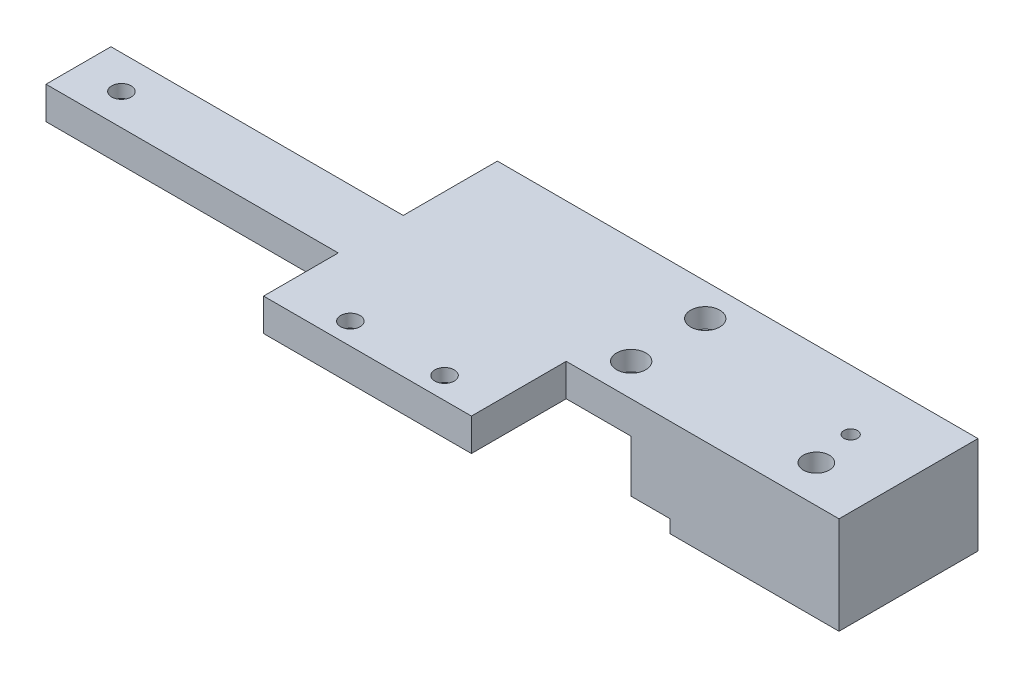
from build123d import *

# Parameters (mm, degrees)
SKETCH_1_W           = 42
SKETCH_1_H           = 21.4
EXTRUDE_1_DEPTH      = 12
SKETCH_2_W           = 6
SKETCH_2_H           = 2
CUT_EXTRUDE_1_DEPTH  = 49.641134855
SKETCH_3_R           = 5
CUT_EXTRUDE_2_DEPTH  = 5.5
SKETCH_3_3_R         = 8.5
CUT_EXTRUDE_3_DEPTH  = 3
SKETCH_3_4_R         = 3.5
CUT_EXTRUDE_4_DEPTH  = 7
SKETCH_3_5_R         = 5
CUT_EXTRUDE_5_DEPTH  = 8.5
CUT_EXTRUDE_START    = -8.5
SKETCH_3_6_R         = 3.1
CUT_EXTRUDE_6_DEPTH  = 2.6
CUT_EXTRUDE_START_2  = -5.5
SKETCH_3_7_R         = 3.1
CUT_EXTRUDE_7_DEPTH  = 2.6
EXTRUDE_START        = -2
SKETCH_4_W           = 42
SKETCH_4_H           = 21.4
SKETCH_4_W_2         = 45
SKETCH_4_H_2         = 10
EXTRUDE_2_DEPTH      = 5
SKETCH_5_R           = 2.25
CUT_EXTRUDE_8_DEPTH  = 3
SKETCH_5_3_R         = 1.5
CUT_EXTRUDE_9_DEPTH  = 86.586213843
SKETCH_3_8_R         = 1.05
SKETCH_3_8_R_2       = 2
CUT_EXTRUDE_10_DEPTH = 87.313382508
SKETCH_6_R           = 1.5
CUT_EXTRUDE_11_DEPTH = 87.313382508
SKETCH_6_3_R         = 2.25
CUT_EXTRUDE_12_DEPTH = 3
SKETCH_7_R           = 0.8
CUT_EXTRUDE_13_DEPTH = 4
SKETCH_3_9_R         = 3.1
CUT_EXTRUDE_14_DEPTH = 2.6


with BuildPart() as part:
    # 草图1 → 凸台-拉伸1 (new body)
    with BuildSketch(Plane(origin=(0, 0, 0), x_dir=(1, 0, 0), z_dir=(0, 1, 0))):
        with Locations((21, -10.7)):
            Rectangle(SKETCH_1_W, SKETCH_1_H)
    extrude(amount=EXTRUDE_1_DEPTH)

    # 草图2 → 切除-拉伸1 (cut, through all)
    with BuildSketch(Plane(origin=(0, 0, 0), x_dir=(-1, 0, 0), z_dir=(0, 0, -1))):
        Polygon((-10, 0), (0, 0), (0, 10), (-10, 10), (-10, 2), align=None)
        with Locations((-13, 1)):
            Rectangle(SKETCH_2_W, SKETCH_2_H)
    extrude(amount=-CUT_EXTRUDE_1_DEPTH, mode=Mode.SUBTRACT)

    # 草图3 → 切除-拉伸2 (cut)
    with BuildSketch(Plane.XZ):
        with Locations(Location((20.3, 7.4, 0), (0, 0, 270))):
            Circle(SKETCH_3_R)
    extrude(amount=-CUT_EXTRUDE_2_DEPTH, mode=Mode.SUBTRACT)

    # 草图3<3> → 切除-拉伸3 (cut)
    with BuildSketch(Plane.XZ):
        with Locations((31.64970263, 9.253173011)):
            Circle(SKETCH_3_3_R)
    extrude(amount=-CUT_EXTRUDE_3_DEPTH, mode=Mode.SUBTRACT)

    # 草图3<4> → 切除-拉伸4 (cut)
    with BuildSketch(Plane.XZ):
        with Locations(Location((31.64970263, 9.253173011, 0), (0, 0, 270))):
            Circle(SKETCH_3_4_R)
    extrude(amount=-CUT_EXTRUDE_4_DEPTH, mode=Mode.SUBTRACT)

    # 草图3<5> → 切除-拉伸5 (cut)
    with BuildSketch(Plane.XZ):
        with Locations(Location((32.76916715, 15.656047301, 0), (0, 0, 270))):
            Circle(SKETCH_3_5_R)
    extrude(amount=-CUT_EXTRUDE_5_DEPTH, mode=Mode.SUBTRACT)

    # 草图3<6> → 切除-拉伸6 (cut)
    with BuildSketch(Plane.XZ.offset(CUT_EXTRUDE_START)):
        with Locations(Location((32.76916715, 15.656047301, 0), (0, 0, 270))):
            Circle(SKETCH_3_6_R)
    extrude(amount=-CUT_EXTRUDE_6_DEPTH, mode=Mode.SUBTRACT)

    # 草图3<7> → 切除-拉伸7 (cut)
    with BuildSketch(Plane.XZ.offset(CUT_EXTRUDE_START_2)):
        with Locations(Location((20.3, 7.4, 0), (0, 0, 270))):
            Circle(SKETCH_3_7_R)
    extrude(amount=-CUT_EXTRUDE_7_DEPTH, mode=Mode.SUBTRACT)

    # 草图4 → 凸台-拉伸2 (add)
    with BuildSketch(Plane(origin=(0, 12, 0), x_dir=(1, 0, 0), z_dir=(0, 1, 0)).offset(EXTRUDE_START)):
        with Locations((21, -10.7)):
            Rectangle(SKETCH_4_W, SKETCH_4_H)
        Polygon((0, -21.4), (0, 0), (-32, 0), (-32, -14.5), (-32, -24.5), (-32, -36), (0, -36), align=None)
        with Locations((-54.5, -19.5)):
            Rectangle(SKETCH_4_W_2, SKETCH_4_H_2)
    extrude(amount=EXTRUDE_2_DEPTH)

    # 草图5 → 切除-拉伸8 (cut)
    with BuildSketch(Plane.XZ.offset(-10)):
        with Locations((-7.480832871, 32.656047307)):
            Circle(SKETCH_5_R)
        with Locations((-21.980832871, 32.656047307)):
            Circle(SKETCH_5_R)
        with Locations((-70.230832871, 19.656047307)):
            Circle(SKETCH_5_R)
    extrude(amount=-CUT_EXTRUDE_8_DEPTH, mode=Mode.SUBTRACT)

    # 草图5<3> → 切除-拉伸9 (cut, through all)
    with BuildSketch(Plane.XZ.offset(-10)):
        with Locations((-70.230832871, 19.656047307)):
            Circle(SKETCH_5_3_R)
        with Locations((-21.980832871, 32.656047307)):
            Circle(SKETCH_5_3_R)
        with Locations((-7.480832871, 32.656047307)):
            Circle(SKETCH_5_3_R)
    extrude(amount=-CUT_EXTRUDE_9_DEPTH, mode=Mode.SUBTRACT)

    # 草图3<8> → 切除-拉伸10 (cut, through all)
    with BuildSketch(Plane.XZ):
        with Locations(Location((31.64970263, 9.253173011, 0), (0, 0, 270))):
            Circle(SKETCH_3_8_R)
        with Locations(Location((32.76916715, 15.656047301, 0), (0, 0, 270))):
            Circle(SKETCH_3_8_R_2)
    extrude(amount=-CUT_EXTRUDE_10_DEPTH, mode=Mode.SUBTRACT)

    # 草图6 → 切除-拉伸11 (cut, through all)
    with BuildSketch(Plane(origin=(0, 15, 0), x_dir=(1, 0, 0), z_dir=(0, 1, 0))):
        with Locations(Location((5, -5, 0), (0, 0, 180))):
            Circle(SKETCH_6_R)
        with Locations(Location((5, -16.4, 0), (0, 0, 180))):
            Circle(SKETCH_6_R)
    extrude(amount=-CUT_EXTRUDE_11_DEPTH, mode=Mode.SUBTRACT)

    # 草图6<3> → 切除-拉伸12 (cut)
    with BuildSketch(Plane(origin=(0, 15, 0), x_dir=(1, 0, 0), z_dir=(0, 1, 0))):
        with Locations(Location((5, -5, 0), (0, 0, 180))):
            Circle(SKETCH_6_3_R)
        with Locations(Location((5, -16.4, 0), (0, 0, 180))):
            Circle(SKETCH_6_3_R)
    extrude(amount=-CUT_EXTRUDE_12_DEPTH, mode=Mode.SUBTRACT)

    # 草图7 → 切除-拉伸13 (cut)
    with BuildSketch(Plane.XZ):
        with Locations(Location((39.5, 18.4, 0), (0, 0, 270))):
            Circle(SKETCH_7_R)
        with Locations(Location((39.5, 2.5, 0), (0, 0, 270))):
            Circle(SKETCH_7_R)
    extrude(amount=-CUT_EXTRUDE_13_DEPTH, mode=Mode.SUBTRACT)

    # 草图3<9> → 切除-拉伸14 (cut)
    with BuildSketch(Plane.XZ.offset(CUT_EXTRUDE_START)):
        with Locations(Location((32.76916715, 15.656047301, 0), (0, 0, 270))):
            Circle(SKETCH_3_9_R)
    extrude(amount=-CUT_EXTRUDE_14_DEPTH, mode=Mode.SUBTRACT)


solid = part.part
